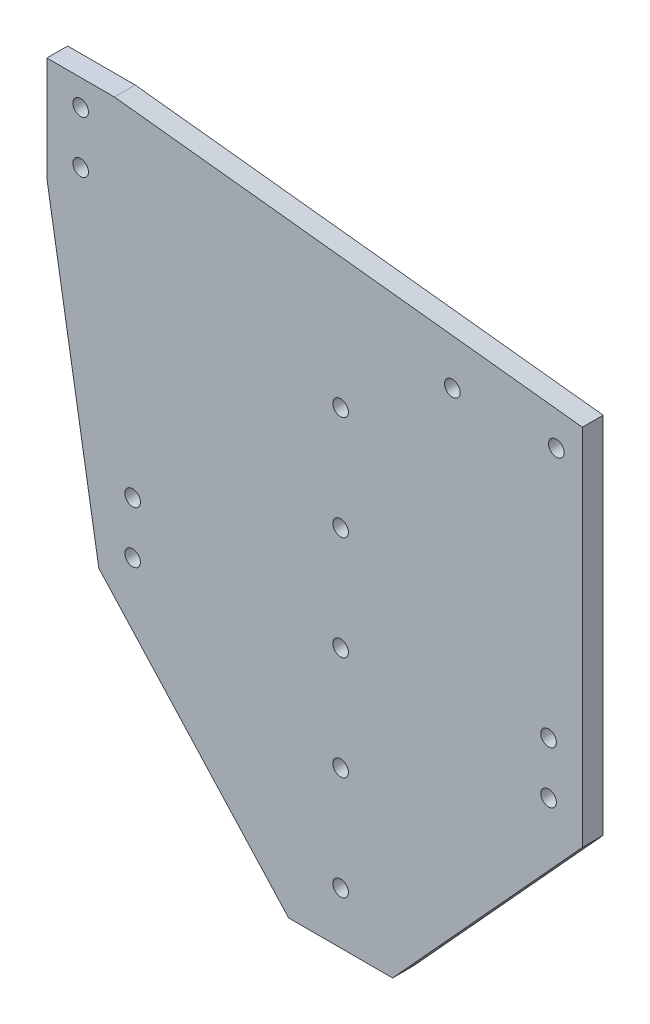
from build123d import *

# Parameters (mm, degrees)
SKETCH_1_R      = 1.5
EXTRUDE_1_DEPTH = 4


with BuildPart() as part:
    # 草图1 → 凸台-拉伸1 (new body)
    with BuildSketch(Plane.XY):
        Polygon((0, 0), (0, 70), (-90, 80), (-103, 80), (-103, 60), (-93, 0), (-56.5, -40), (-36.5, -40), align=None)
        with Locations((-86.5, 15)):
            Circle(SKETCH_1_R, mode=Mode.SUBTRACT)
        with Locations(Location((-86.5, 5, 0), (0, 0, 180))):
            Circle(SKETCH_1_R, mode=Mode.SUBTRACT)
        with Locations((-6.5, 5)):
            Circle(SKETCH_1_R, mode=Mode.SUBTRACT)
        with Locations(Location((-6.5, 15, 0), (0, 0, 180))):
            Circle(SKETCH_1_R, mode=Mode.SUBTRACT)
        with Locations((-96.5, 75)):
            Circle(SKETCH_1_R, mode=Mode.SUBTRACT)
        with Locations((-96.5, 65)):
            Circle(SKETCH_1_R, mode=Mode.SUBTRACT)
        with Locations((-46.5, 10)):
            Circle(SKETCH_1_R, mode=Mode.SUBTRACT)
        with Locations((-46.5, 30)):
            Circle(SKETCH_1_R, mode=Mode.SUBTRACT)
        with Locations((-46.5, 50)):
            Circle(SKETCH_1_R, mode=Mode.SUBTRACT)
        with Locations((-46.5, -10)):
            Circle(SKETCH_1_R, mode=Mode.SUBTRACT)
        with Locations((-46.5, -30)):
            Circle(SKETCH_1_R, mode=Mode.SUBTRACT)
        with Locations((-5, 64)):
            Circle(SKETCH_1_R, mode=Mode.SUBTRACT)
        with Locations((-25, 64)):
            Circle(SKETCH_1_R, mode=Mode.SUBTRACT)
    extrude(amount=EXTRUDE_1_DEPTH)


solid = part.part
